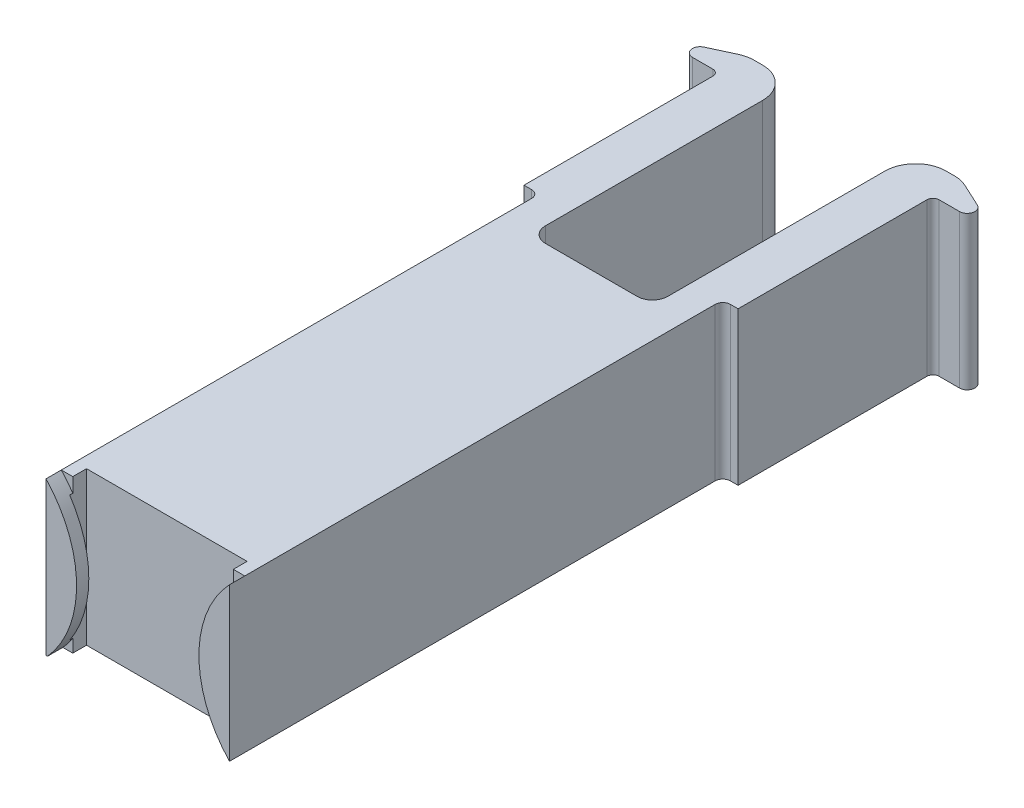
from build123d import *

# Parameters (mm, degrees)
BOSS_EXTRUDE1_DEPTH = 5
FILLET2_R           = 0.2
FILLET3_R           = 1
FILLET6_R           = 0.5
SKETCH3_W           = 7
SKETCH3_H           = 5
BOSS_EXTRUDE2_DEPTH = 7.2
SKETCH4_W           = 6
SKETCH4_H           = 5
BOSS_EXTRUDE3_DEPTH = 3.13
SKETCH5_W           = 5.25
SKETCH5_H           = 0.55
CUT_EXTRUDE1_DEPTH  = 6
FILLET8_R           = 0.25
SKETCH9_W           = 0.605295755
SKETCH9_H           = 5
CUT_EXTRUDE5_DEPTH  = 13
SKETCH10_W          = 0.5
SKETCH10_H          = 5
CUT_EXTRUDE6_DEPTH  = 13
FILLET16_R          = 0.25
SKETCH12_W          = 4
SKETCH12_H          = 5
CUT_EXTRUDE7_DEPTH  = 0.4
CUT_EXTRUDE8_DEPTH  = 0.5


with BuildPart() as part:
    # Sketch2 → Boss-Extrude1 (new body)
    with BuildSketch(Plane(origin=(0, 0, 0), x_dir=(1, 0, 0), z_dir=(0, 1, 0))):
        Polygon((-3.445470037, -4.119402442), (3.554529963, -4.119402442), (3.554529963, 8.054782302), (5.554529963, 8.054782302), (3.554529963, 8.982336318), (2.054529963, 8.982336318), (2.054529963, 0.380597558), (-1.945470037, 0.380597558), (-1.945470037, 8.982336318), (-3.445470037, 8.982336318), (-5.445470037, 8.054782302), (-3.445470037, 8.054782302), align=None)
    extrude(amount=BOSS_EXTRUDE1_DEPTH)

    # Fillet2
    fillet2_edges = [part.edges().sort_by_distance(p)[0] for p in [
        (-3.445470037, 2.5, -8.054782302),
        (3.554529963, 2.5, -8.054782302),
    ]]
    fillet(fillet2_edges, radius=FILLET2_R)

    # Fillet3
    fillet3_edges = [part.edges().sort_by_distance(p)[0] for p in [
        (-3.445470037, 2.5, -8.982336318),
        (-1.945470037, 2.5, -8.982336318),
        (2.054529963, 2.5, -8.982336318),
        (3.554529963, 2.5, -8.982336318),
    ]]
    fillet(fillet3_edges, radius=FILLET3_R)

    # Fillet6
    fillet6_edges = [part.edges().sort_by_distance(p)[0] for p in [
        (-1.945470037, 2.5, -0.380597558),
        (2.054529963, 2.5, -0.380597558),
    ]]
    fillet(fillet6_edges, radius=FILLET6_R)

    # Sketch3 → Boss-Extrude2 (add)
    with BuildSketch(Plane.XY.offset(4.119402442)):
        with Locations((0.054529963, 2.5)):
            Rectangle(SKETCH3_W, SKETCH3_H)
    extrude(amount=BOSS_EXTRUDE2_DEPTH)

    # Sketch4 → Boss-Extrude3 (add)
    with BuildSketch(Plane.XY.offset(11.319402442)):
        with Locations((0.054529963, 2.5)):
            Rectangle(SKETCH4_W, SKETCH4_H)
    extrude(amount=BOSS_EXTRUDE3_DEPTH)

    # Sketch5 → Cut-Extrude1 (cut)
    with BuildSketch(Plane(origin=(0, 5, 0), x_dir=(1, 0, 0), z_dir=(0, 1, 0))):
        with Locations((0.054529963, -13.774402442)):
            Rectangle(SKETCH5_W, SKETCH5_H)
    extrude(amount=-CUT_EXTRUDE1_DEPTH, mode=Mode.SUBTRACT)

    # Fillet8
    fillet8_edges = [part.edges().sort_by_distance(p)[0] for p in [
        (-5.445470037, 2.5, -8.054782302),
        (5.554529963, 2.5, -8.054782302),
    ]]
    fillet(fillet8_edges, radius=FILLET8_R)

    # Sketch9 → Cut-Extrude5 (cut)
    with BuildSketch(Plane.XY.offset(11.319402442)):
        with Locations((-3.248117915, 2.5)):
            Rectangle(SKETCH9_W, SKETCH9_H)
    extrude(amount=-CUT_EXTRUDE5_DEPTH, mode=Mode.SUBTRACT)

    # Sketch10 → Cut-Extrude6 (cut)
    with BuildSketch(Plane.XY.offset(11.319402442)):
        with Locations((3.304529963, 2.5)):
            Rectangle(SKETCH10_W, SKETCH10_H)
    extrude(amount=-CUT_EXTRUDE6_DEPTH, mode=Mode.SUBTRACT)

    # Fillet16
    fillet16_edges = [part.edges().sort_by_distance(p)[0] for p in [
        (-2.945470037, 2.5, -1.680597558),
        (3.054529963, 2.5, -1.680597558),
    ]]
    fillet(fillet16_edges, radius=FILLET16_R)

    # Sketch12 → Cut-Extrude7 (cut)
    with BuildSketch(Plane.XY.offset(14.449402442)):
        with Locations((0.054529963, 2.5)):
            Rectangle(SKETCH12_W, SKETCH12_H)
    extrude(amount=-CUT_EXTRUDE7_DEPTH, mode=Mode.SUBTRACT)

    # Sketch14 → Cut-Extrude8 (cut)
    with BuildSketch(Plane.XY.offset(14.449402442)):
        with BuildLine():
            Line((-1.945470037, 5), (-2.945470037, 5))
            ThreePointArc((-2.945470037, 5), (-2.204559454, 3.831888923), (-1.945470037, 2.473100986))
            Line((-1.945470037, 2.473100986), (-1.945470037, 5))
        make_face()
        with BuildLine():
            Line((-1.945470037, 0), (-1.945470037, 2.473100986))
            ThreePointArc((-1.945470037, 2.473100986), (-2.191277733, 1.14836624), (-2.895975223, 0))
            Line((-2.895975223, 0), (-1.945470037, 0))
        make_face()
        with BuildLine():
            Line((2.054529963, 0), (3.054529963, 0))
            ThreePointArc((3.054529963, 0), (2.313801958, 1.153708798), (2.054529963, 2.5))
            Line((2.054529963, 2.5), (2.054529963, 0))
        make_face()
        with BuildLine():
            ThreePointArc((2.054529963, 2.5), (2.313801958, 3.846291202), (3.054529963, 5))
            Line((3.054529963, 5), (2.054529963, 5))
            Line((2.054529963, 5), (2.054529963, 2.5))
        make_face()
    extrude(amount=-CUT_EXTRUDE8_DEPTH, mode=Mode.SUBTRACT)


solid = part.part
